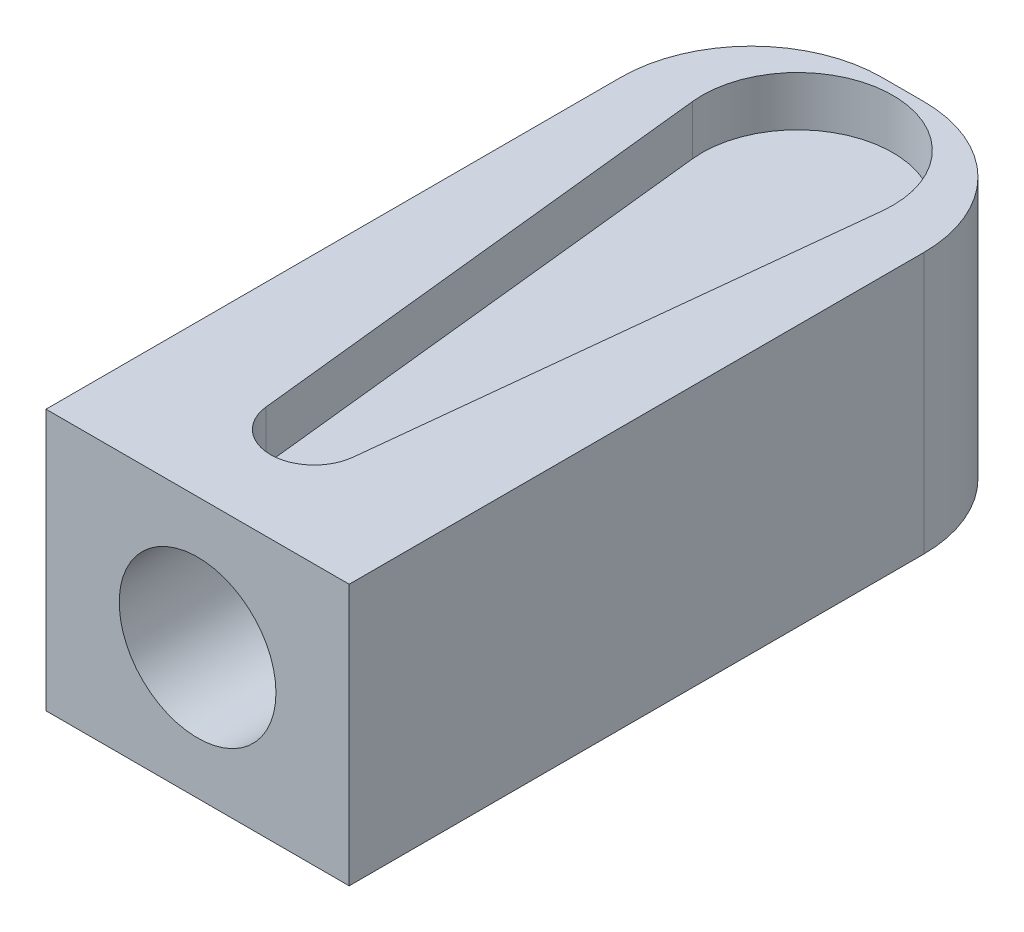
from build123d import *

# Parameters (mm, degrees)
SKETCH1_W           = 11.605976064
SKETCH1_H           = 10
SKETCH1_R           = 3
BOSS_EXTRUDE1_DEPTH = 25
SKETCH2_W           = 11.605976064
SKETCH2_H           = 10
BOSS_EXTRUDE2_DEPTH = 2
FILLET1_R           = 5
CUT_EXTRUDE1_DEPTH  = 1.9


with BuildPart() as part:
    # Sketch1 → Boss-Extrude1 (new body)
    with BuildSketch(Plane.XY):
        Rectangle(SKETCH1_W, SKETCH1_H)
        Circle(SKETCH1_R, mode=Mode.SUBTRACT)
    extrude(amount=BOSS_EXTRUDE1_DEPTH)

    # Sketch2 → Boss-Extrude2 (add)
    with BuildSketch(Plane(origin=(0, 0, 0), x_dir=(-1, 0, 0), z_dir=(0, 0, -1))):
        Rectangle(SKETCH2_W, SKETCH2_H)
    extrude(amount=BOSS_EXTRUDE2_DEPTH)

    # Fillet1
    fillet1_edges = [part.edges().sort_by_distance(p)[0] for p in [
        (5.802988032, 0, -2),
        (-5.802988032, 0, -2),
    ]]
    fillet(fillet1_edges, radius=FILLET1_R)

    # Sketch3 → Cut-Extrude1 (cut)
    with BuildSketch(Plane(origin=(0, 5, 0), x_dir=(1, 0, 0), z_dir=(0, 1, 0))):
        with BuildLine():
            Line((3.629140862, -2.424827665), (1.665427656, -20.71398307))
            ThreePointArc((1.665427656, -20.71398307), (0, -22.210165502), (-1.665427656, -20.71398307))
            Line((-1.665427656, -20.71398307), (-3.629140862, -2.424827665))
            ThreePointArc((-3.629140862, -2.424827665), (0, 1.614834498), (3.629140862, -2.424827665))
        make_face()
    extrude(amount=-CUT_EXTRUDE1_DEPTH, mode=Mode.SUBTRACT)


solid = part.part
